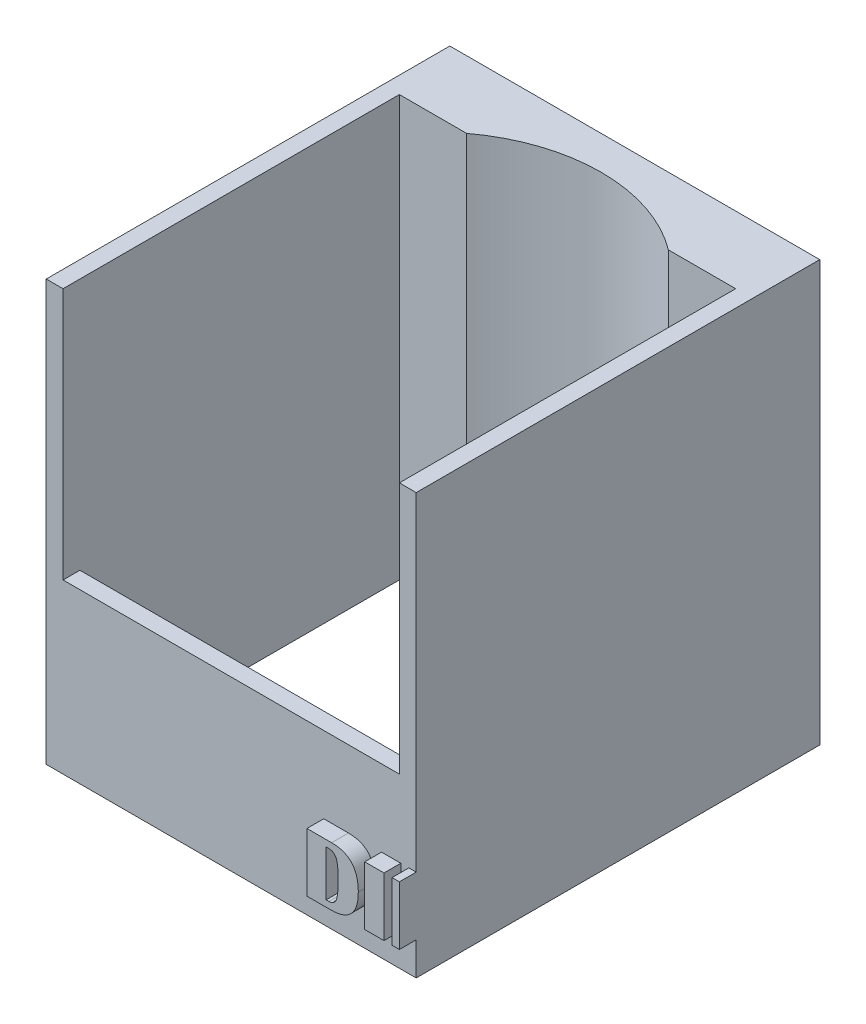
from build123d import *

# Parameters (mm, degrees)
SKETCH1_W                      = 670
SKETCH1_H                      = 120
BOSS_EXTRUDE1_DEPTH            = 530
SKETCH2_W                      = 100
SKETCH2_H                      = 200
SKETCH2_W_2                    = 650
SKETCH2_H_2                    = 250
CUT_EXTRUDE1_DEPTH             = 100
SKETCH3_R                      = 50
CUT_EXTRUDE2_DEPTH             = 260
F_12_0_12_DIAMETER_HOLE2_D     = 12
F_12_0_12_DIAMETER_HOLE2_DEPTH = 30
F_12_0_12_DIAMETER_HOLE2_TIP   = 3.605163714
SKETCH8_W                      = 650
SKETCH8_H                      = 50
BOSS_EXTRUDE2_DEPTH            = 5
SKETCH9_W                      = 10
SKETCH9_H                      = 250
CUT_EXTRUDE3_DEPTH             = 717
CUT_EXTRUDE4_DEPTH             = 5
SKETCH11_W                     = 10
SKETCH11_H                     = 100
BOSS_EXTRUDE3_DEPTH            = 78
BOSS_EXTRUDE3_2_DEPTH          = 78
BOSS_EXTRUDE3_3_DEPTH          = 78
SKETCH12_W                     = 20
SKETCH12_H                     = 30
CUT_EXTRUDE5_DEPTH             = 80
SKETCH15_W                     = 30
SKETCH15_H                     = 23.536156656
SKETCH15_H_2                   = 28.986603691
CUT_EXTRUDE7_DEPTH             = 35
SHELL1_T                       = -3
SKETCH16_W                     = 14
SKETCH16_H                     = 14
CUT_EXTRUDE8_DEPTH             = 35
SKETCH17_W                     = 5.729882812
SKETCH17_H                     = 17.428393554
SKETCH17_W_2                   = 13.369726562
SKETCH17_H_2                   = 3.342431641
BOSS_EXTRUDE4_DEPTH            = 5
SKETCH18_W                     = 670
SKETCH18_H                     = 280
CUT_EXTRUDE10_DEPTH            = 159
CUT_EXTRUDE11_DEPTH            = 863.670273187
CUT_EXTRUDE11_DEPTH_BACK       = 863.670273187
SKETCH19_W                     = 115
SKETCH19_H                     = 250
SKETCH19_W_2                   = 445
CUT_EXTRUDE12_DEPTH            = 777.739982373
CUT_EXTRUDE12_DEPTH_BACK       = 777.739982373
SKETCH20_W                     = 110
SKETCH20_H                     = 125


with BuildPart() as part:
    # Sketch1 → Boss-Extrude1 (new body)
    with BuildSketch(Plane(origin=(0, 0, 0), x_dir=(1, 0, 0), z_dir=(0, 1, 0))):
        with Locations((335, 60)):
            Rectangle(SKETCH1_W, SKETCH1_H)
    extrude(amount=BOSS_EXTRUDE1_DEPTH)

    # Sketch2 → Cut-Extrude1 (cut)
    with BuildSketch(Plane.XY):
        with Locations((60, 380)):
            Rectangle(SKETCH2_W, SKETCH2_H)
        with Locations((170, 380)):
            Rectangle(SKETCH2_W, SKETCH2_H)
        with Locations((280, 380)):
            Rectangle(SKETCH2_W, SKETCH2_H)
        with Locations((390, 380)):
            Rectangle(SKETCH2_W, SKETCH2_H)
        with Locations((500, 380)):
            Rectangle(SKETCH2_W, SKETCH2_H)
        with Locations((610, 380)):
            Rectangle(SKETCH2_W, SKETCH2_H)
        with Locations((335, 135)):
            Rectangle(SKETCH2_W_2, SKETCH2_H_2)
    extrude(amount=-CUT_EXTRUDE1_DEPTH, mode=Mode.SUBTRACT)

    # Sketch3 → Cut-Extrude2 (cut)
    with BuildSketch(Plane(origin=(0, 530, 0), x_dir=(1, 0, 0), z_dir=(0, 1, 0))):
        with Locations(Location((60, 60, 0), (0, 0, 270))):
            Circle(SKETCH3_R)
        with Locations(Location((170, 60, 0), (0, 0, 270))):
            Circle(SKETCH3_R)
        with Locations(Location((280, 60, 0), (0, 0, 270))):
            Circle(SKETCH3_R)
        with Locations(Location((390, 60, 0), (0, 0, 270))):
            Circle(SKETCH3_R)
        with Locations(Location((500, 60, 0), (0, 0, 270))):
            Circle(SKETCH3_R)
        with Locations(Location((610, 60, 0), (0, 0, 270))):
            Circle(SKETCH3_R)
    extrude(amount=-CUT_EXTRUDE2_DEPTH, mode=Mode.SUBTRACT)

    # Ø12.0 (12) Diameter Hole2
    with Locations(Plane(origin=(59.704642413, 270, -102.411697903), x_dir=(0, 0, 1), z_dir=(0, 1, 0))):
        with Locations((0, 0), (-0.195888006, 111.8520513), (0.014838595, 221.167624818), (-0.341843303, 331.364008353), (0.657723149, 441.008646429), (1.288998006, 549.811854685)):
            Hole(F_12_0_12_DIAMETER_HOLE2_D / 2, depth=F_12_0_12_DIAMETER_HOLE2_DEPTH)
            with Locations((0, 0, -(F_12_0_12_DIAMETER_HOLE2_DEPTH + F_12_0_12_DIAMETER_HOLE2_TIP / 2))):  # 118° drill point
                Cone(0, F_12_0_12_DIAMETER_HOLE2_D / 2, F_12_0_12_DIAMETER_HOLE2_TIP, mode=Mode.SUBTRACT)

    # Sketch8 → Boss-Extrude2 (add)
    with BuildSketch(Plane.XY):
        with Locations((335, 305)):
            Rectangle(SKETCH8_W, SKETCH8_H)
    extrude(amount=-BOSS_EXTRUDE2_DEPTH)

    # Sketch9 → Cut-Extrude3 (cut)
    with BuildSketch(Plane(origin=(670, 0, 0), x_dir=(0, 0, -1), z_dir=(1, 0, 0))):
        with Locations((15, 135)):
            Rectangle(SKETCH9_W, SKETCH9_H)
    extrude(amount=-CUT_EXTRUDE3_DEPTH, mode=Mode.SUBTRACT)

    # Sketch10 → Cut-Extrude4 (cut)
    with BuildSketch(Plane(origin=(0, 10, 0), x_dir=(1, 0, 0), z_dir=(0, 1, 0))):
        Polygon((365, 61.943560596), (350, 87.924322709), (320, 87.924322709), (305, 61.943560596), (320, 35.962798482), (350, 35.962798482), align=None)
    extrude(amount=-CUT_EXTRUDE4_DEPTH, mode=Mode.SUBTRACT)

    # Sketch12 → Cut-Extrude5 (cut)
    with BuildSketch(Plane.XY.offset(-100)):
        with Locations((85.198613037, 245)):
            Rectangle(SKETCH12_W, SKETCH12_H)
        with Locations((195.198613037, 245)):
            Rectangle(SKETCH12_W, SKETCH12_H)
        with Locations((305.198613037, 245)):
            Rectangle(SKETCH12_W, SKETCH12_H)
        with Locations((415.198613037, 245)):
            Rectangle(SKETCH12_W, SKETCH12_H)
        with Locations((525.198613037, 245)):
            Rectangle(SKETCH12_W, SKETCH12_H)
        with Locations((635.198613037, 245)):
            Rectangle(SKETCH12_W, SKETCH12_H)
    extrude(amount=-CUT_EXTRUDE5_DEPTH, mode=Mode.SUBTRACT)

    # Sketch17 → Boss-Extrude4 (add)
    # profile 1 of 9: a face of its own
    with BuildSketch(Plane.XY):
        with BuildLine():
            Line((527.508830928, 289.835452458), (527.508830928, 307.263846012))
            Line((527.508830928, 307.263846012), (534.861434459, 307.263846012))
            add(Edge.make_bspline(
                [(534.861434459, 307.263846012), (535.181337774, 307.258256848), (535.803061116, 307.24739446), (536.703508491, 307.139069344), (537.544992916, 306.975202489), (538.325061607, 306.737496792), (539.040841948, 306.426020155), (539.698044515, 306.051894954), (540.290333057, 305.605079277), (540.822348212, 305.090232636), (541.284521701, 304.502523111), (541.692171296, 303.852565801), (542.030284458, 303.129762281), (542.309377095, 302.341316546), (542.5243908, 301.484161689), (542.679660381, 300.560045938), (542.773357357, 299.567500804), (542.783368073, 298.883107022), (542.788518428, 298.530997273)],
                knots=[0, 0, 0, 0, 1.135059408, 2.20595691, 3.214417064, 4.174978569, 5.094187092, 5.980001006, 6.853065862, 7.720814779, 8.600404634, 9.50058483, 10.438414914, 11.426825708, 12.465239141, 13.571113463, 14.750376389, 16, 16, 16, 16], degree=3))
            add(Edge.make_bspline(
                [(542.788518428, 298.530997273), (542.781740751, 298.180151665), (542.768592871, 297.499553336), (542.676885992, 296.511518461), (542.516733301, 295.591080531), (542.296748778, 294.736450427), (542.003051046, 293.953120444), (541.654236167, 293.233205539), (541.233025793, 292.585291498), (540.753136904, 292.000029304), (540.204772188, 291.484681411), (539.587651059, 291.044279297), (538.910779309, 290.668464036), (538.169670382, 290.361903209), (537.364073889, 290.124869172), (536.495133477, 289.954199984), (535.562644449, 289.853487388), (534.920131033, 289.841584621), (534.58911581, 289.835452458)],
                knots=[0, 0, 0, 0, 1.228418252, 2.382983832, 3.470276728, 4.496757894, 5.468023682, 6.394867725, 7.292157164, 8.167372942, 9.039072913, 9.918728341, 10.815246345, 11.744296628, 12.720973084, 13.750736166, 14.841206188, 16, 16, 16, 16], degree=3))
            Line((534.58911581, 289.835452458), (527.508830928, 289.835452458))
        make_face()
        with BuildLine():
            Line((533.238713741, 291.745413395), (534.048208904, 291.745413395))
            add(Edge.make_bspline(
                [(534.048208904, 291.745413395), (534.172894012, 291.749291978), (534.413033311, 291.756761998), (534.758676231, 291.825976613), (535.075745017, 291.938271137), (535.365749176, 292.094802589), (535.623404602, 292.300450923), (535.848862806, 292.551404902), (536.04776914, 292.844737637), (536.217685755, 293.190205032), (536.364284647, 293.596533622), (536.481764702, 294.076367921), (536.592118304, 294.630928744), (536.673672739, 295.265507643), (536.740044562, 295.978448886), (536.788346679, 296.768428292), (536.812018936, 297.636801208), (536.817188964, 298.241258393), (536.819890499, 298.55711002)],
                knots=[0, 0, 0, 0, 0.728710832, 1.403472396, 2.052289494, 2.690292559, 3.321919393, 3.970736491, 4.656696891, 5.388631723, 6.217040872, 7.17856157, 8.275589967, 9.523440737, 10.918935818, 12.463926104, 14.152268318, 16, 16, 16, 16], degree=3))
            add(Edge.make_bspline(
                [(536.819890499, 298.55711002), (536.8171426, 298.871715251), (536.811863063, 299.476166083), (536.7886758, 300.343334385), (536.739579947, 301.133216935), (536.674703848, 301.843934916), (536.589660404, 302.476324031), (536.488366458, 303.031681737), (536.362441588, 303.507627045), (536.222158727, 303.914921549), (536.050140993, 304.256514038), (535.858357073, 304.554097881), (535.62547107, 304.79746827), (535.36991257, 305.004888479), (535.079348843, 305.160875844), (534.761320266, 305.273944358), (534.414185903, 305.34216807), (534.172870641, 305.349893944), (534.048208904, 305.353885075)],
                knots=[0, 0, 0, 0, 1.842836665, 3.540640921, 5.080358154, 6.47765669, 7.719902824, 8.816971715, 9.781579111, 10.601733135, 11.334613876, 12.017393917, 12.666641099, 13.29908421, 13.937911793, 14.587567384, 15.270347425, 16, 16, 16, 16], degree=3))
            Line((534.048208904, 305.353885075), (533.238713741, 305.353885075))
            Line((533.238713741, 305.353885075), (533.238713741, 291.745413395))
        make_face(mode=Mode.SUBTRACT)
    # profile 2 of 9: a face of its own
    with BuildSketch(Plane.XY):
        with Locations((547.563420772, 298.549649235)):
            Rectangle(SKETCH17_W, SKETCH17_H)
    # profile 3 of 9: a face of its own
    with BuildSketch(Plane.XY):
        Polygon((564.514324092, 307.263846012), (564.514324092, 305.115139958), (558.545696163, 305.115139958), (558.545696163, 299.862747379), (563.559343624, 299.862747379), (563.559343624, 297.714041325), (558.545696163, 297.714041325), (558.545696163, 289.835452458), (552.81581335, 289.835452458), (552.81581335, 307.263846012), align=None)
    # profile 4 of 9: a face of its own
    with BuildSketch(Plane.XY):
        Polygon((577.645305538, 307.263846012), (577.645305538, 305.115139958), (571.676677608, 305.115139958), (571.676677608, 299.862747379), (576.690325069, 299.862747379), (576.690325069, 297.714041325), (571.676677608, 297.714041325), (571.676677608, 289.835452458), (565.946794795, 289.835452458), (565.946794795, 307.263846012), align=None)
    # profile 5 of 9: a face of its own
    with BuildSketch(Plane.XY):
        with Locations((584.330168819, 287.448001286)):
            Rectangle(SKETCH17_W_2, SKETCH17_H_2)
    # profile 6 of 9: a face of its own
    with BuildSketch(Plane.XY):
        with BuildLine():
            Line((605.578484249, 307.263846012), (605.578484249, 295.602639195))
            add(Edge.make_bspline(
                [(605.578484249, 295.602639195), (605.574209777, 295.35989389), (605.565919345, 294.889083964), (605.480877158, 294.20653885), (605.349958188, 293.569747554), (605.15926554, 292.978838165), (604.911867049, 292.436847071), (604.616163877, 291.936663973), (604.260702644, 291.487723021), (603.847299908, 291.08966617), (603.386881991, 290.731670113), (602.867295001, 290.425440037), (602.293741958, 290.168488385), (601.66690529, 289.960990771), (600.988052682, 289.797299786), (600.254912883, 289.679078851), (599.467035781, 289.60781007), (598.923618241, 289.60048219), (598.643684673, 289.59670734)],
                knots=[0, 0, 0, 0, 1.108173197, 2.149326602, 3.136215123, 4.073726706, 4.978516626, 5.852185058, 6.72141202, 7.584905625, 8.467554395, 9.379216169, 10.332422268, 11.332766067, 12.390653242, 13.518530507, 14.721707419, 16, 16, 16, 16], degree=3))
            add(Edge.make_bspline(
                [(598.643684673, 289.59670734), (598.373688491, 289.600411437), (597.851346557, 289.607577482), (597.093280473, 289.679448684), (596.387523889, 289.797736542), (595.733050135, 289.960122315), (595.130189942, 290.169220301), (594.579048171, 290.42623041), (594.078350789, 290.732835498), (593.633858028, 291.090104794), (593.234289459, 291.486851767), (592.899913678, 291.940746827), (592.609043638, 292.435866034), (592.375223767, 292.980322997), (592.191754821, 293.570441519), (592.063541006, 294.20666921), (591.983676196, 294.889343196), (591.974661767, 295.359932437), (591.970012569, 295.602639195)],
                knots=[0, 0, 0, 0, 1.258901956, 2.435505865, 3.547148904, 4.59359074, 5.576649289, 6.5183682, 7.424469602, 8.307507093, 9.172751023, 10.042627298, 10.928839176, 11.845659241, 12.799442865, 13.80597989, 14.868432463, 16, 16, 16, 16], degree=3))
            Line((591.970012569, 295.602639195), (591.970012569, 307.263846012))
            Line((591.970012569, 307.263846012), (597.699895381, 307.263846012))
            Line((597.699895381, 307.263846012), (597.699895381, 295.457153889))
            add(Edge.make_bspline(
                [(597.699895381, 295.457153889), (597.700816195, 295.287996189), (597.702584578, 294.963135903), (597.729908723, 294.499051493), (597.768241004, 294.079064133), (597.828226169, 293.705517832), (597.90066041, 293.377063412), (597.989882091, 293.09281535), (598.094998068, 292.852496478), (598.225239063, 292.654232043), (598.380826623, 292.495135011), (598.55368342, 292.353231761), (598.757556996, 292.238543846), (598.987648905, 292.146224908), (599.243380948, 292.070549638), (599.526120553, 292.020376099), (599.83553351, 291.990763905), (600.049971942, 291.986424568), (600.161954402, 291.984158512)],
                knots=[0, 0, 0, 0, 1.622370975, 3.115695595, 4.458049099, 5.666011203, 6.742434742, 7.681714947, 8.519814998, 9.250928664, 9.942747364, 10.646898194, 11.389596108, 12.175933929, 13.021386247, 13.943159715, 14.925891993, 16, 16, 16, 16], degree=3))
            add(Edge.make_bspline(
                [(600.161954402, 291.984158512), (600.283927219, 291.987190593), (600.521124756, 291.993087005), (600.86597014, 292.03390861), (601.187714881, 292.103380086), (601.484890424, 292.205377303), (601.758665297, 292.332852529), (602.012761516, 292.484567923), (602.236391413, 292.674631152), (602.439076761, 292.888441291), (602.620738276, 293.128529789), (602.771757722, 293.399928575), (602.905501548, 293.697121508), (603.005823683, 294.025060118), (603.089837826, 294.379999499), (603.146989706, 294.763086929), (603.186210275, 295.174074524), (603.189394751, 295.457053988), (603.191033077, 295.602639195)],
                knots=[0, 0, 0, 0, 1.083870311, 2.107775948, 3.08105344, 4.003637981, 4.893545291, 5.761570557, 6.624657808, 7.49233129, 8.376387281, 9.291996285, 10.246843261, 11.267344133, 12.334180325, 13.486053461, 14.706643157, 16, 16, 16, 16], degree=3))
            Line((603.191033077, 295.602639195), (603.191033077, 307.263846012))
            Line((603.191033077, 307.263846012), (605.578484249, 307.263846012))
        make_face()
    # profile 7 of 9: a face of its own
    with BuildSketch(Plane.XY):
        with BuildLine():
            Line((619.731593227, 302.015183827), (616.739818477, 301.526502415))
            add(Edge.make_bspline(
                [(616.739818477, 301.526502415), (616.748849224, 301.670726223), (616.765660669, 301.939210177), (616.78429066, 302.312269209), (616.796668381, 302.625642376), (616.798628236, 302.814722915), (616.799504756, 302.899286839)],
                knots=[0, 0, 0, 0, 1.261802504, 2.348944521, 3.261585937, 4, 4, 4, 4], degree=3))
            add(Edge.make_bspline(
                [(616.799504756, 302.899286839), (616.798306068, 303.007660677), (616.795968139, 303.219033721), (616.750451916, 303.523894877), (616.694806916, 303.811547356), (616.604352699, 304.076787391), (616.488181329, 304.320314265), (616.348943917, 304.543955606), (616.184187178, 304.745078709), (615.995833421, 304.928129987), (615.778009957, 305.083200131), (615.536269472, 305.218702836), (615.269765326, 305.333844758), (614.978065514, 305.431346685), (614.660683072, 305.504624438), (614.319025281, 305.556776695), (613.952471696, 305.585673441), (613.699597795, 305.590260771), (613.568984889, 305.592630192)],
                knots=[0, 0, 0, 0, 1.079280541, 2.105035848, 3.067950317, 3.99715044, 4.889989748, 5.753421302, 6.617030865, 7.476358039, 8.364190572, 9.274590025, 10.235106994, 11.254473582, 12.337095886, 13.478601727, 14.697662529, 16, 16, 16, 16], degree=3))
            add(Edge.make_bspline(
                [(613.568984889, 305.592630192), (613.391954632, 305.58912286), (613.059112606, 305.582528579), (612.595688488, 305.495339748), (612.198743126, 305.361419257), (611.87165349, 305.163811893), (611.613188167, 304.909795747), (611.433841092, 304.593316589), (611.323009072, 304.224665915), (611.313400221, 303.959558324), (611.308367061, 303.820693775)],
                knots=[0, 0, 0, 0, 1.294917039, 2.43462794, 3.440028966, 4.347597256, 5.210608309, 6.06356377, 6.985685997, 8, 8, 8, 8], degree=3))
            add(Edge.make_bspline(
                [(611.308367061, 303.820693775), (611.317562032, 303.705133219), (611.336106628, 303.472068433), (611.47315858, 303.132808312), (611.695999602, 302.811560885), (612.009295906, 302.510664216), (612.404107796, 302.221967273), (612.884407504, 301.948533431), (613.450813789, 301.688189695), (613.862519081, 301.536023727), (614.080048656, 301.455624958)],
                knots=[0, 0, 0, 0, 0.716839541, 1.445735977, 2.240793036, 3.131329288, 4.131129903, 5.273471266, 6.559404876, 8, 8, 8, 8], degree=3))
            add(Edge.make_bspline(
                [(614.080048656, 301.455624958), (614.335934702, 301.364918412), (614.834564244, 301.188164095), (615.547657928, 300.88707802), (616.213068388, 300.5749594), (616.829579094, 300.246613346), (617.397833174, 299.90520698), (617.914851624, 299.544556457), (618.386199073, 299.173962102), (618.807001026, 298.783874588), (619.177995113, 298.378100064), (619.4958685, 297.952745357), (619.771807525, 297.51723103), (619.991113975, 297.061458502), (620.169645242, 296.594624218), (620.292698657, 296.11024444), (620.364288243, 295.609761088), (620.37516617, 295.270864226), (620.380681514, 295.099036213)],
                knots=[0, 0, 0, 0, 1.359488612, 2.649152603, 3.874964776, 5.039588756, 6.146130126, 7.193090393, 8.194917302, 9.146793662, 10.063845301, 10.944476293, 11.803344532, 12.641736646, 13.473440096, 14.302714936, 15.139439897, 16, 16, 16, 16], degree=3))
            add(Edge.make_bspline(
                [(620.380681514, 295.099036213), (620.374476075, 294.902306495), (620.362285176, 294.515820995), (620.280160209, 293.948630617), (620.138011896, 293.409496554), (619.938489338, 292.895972278), (619.681049879, 292.411946655), (619.366518754, 291.954381076), (618.996510229, 291.525099427), (618.5710008, 291.128381035), (618.102222518, 290.765302239), (617.587803957, 290.450854345), (617.034458515, 290.187092261), (616.444107988, 289.968993032), (615.81453624, 289.801373099), (615.145337453, 289.685291013), (614.438790193, 289.606619894), (613.954683001, 289.600062276), (613.70700941, 289.59670734)],
                knots=[0, 0, 0, 0, 0.972121714, 1.909782367, 2.824924061, 3.721832975, 4.62620438, 5.527836938, 6.46026819, 7.421000932, 8.398101015, 9.385579713, 10.394244048, 11.422703992, 12.491421888, 13.608778581, 14.776629625, 16, 16, 16, 16], degree=3))
            add(Edge.make_bspline(
                [(613.70700941, 289.59670734), (613.445745367, 289.599650312), (612.939893069, 289.605348413), (612.207608113, 289.66709241), (611.525297432, 289.760984454), (610.893395078, 289.899706116), (610.309273131, 290.072394336), (609.776099392, 290.288320955), (609.295310255, 290.547303481), (608.863217672, 290.843007892), (608.478306623, 291.175775461), (608.148120946, 291.551766865), (607.86942369, 291.967163224), (607.639947144, 292.421521488), (607.466477665, 292.917583541), (607.339164663, 293.449829748), (607.264537999, 294.021332449), (607.254747521, 294.414908557), (607.249700069, 294.617815586)],
                knots=[0, 0, 0, 0, 1.342201143, 2.598733168, 3.773451092, 4.878874364, 5.91991243, 6.900006476, 7.829142054, 8.72062616, 9.585588575, 10.436728592, 11.283829734, 12.149664931, 13.044964919, 13.977937424, 14.957531465, 16, 16, 16, 16], degree=3))
            add(Edge.make_bspline(
                [(607.249700069, 294.617815586), (607.250803815, 294.692425759), (607.253213998, 294.855347393), (607.260452266, 295.122772538), (607.275636683, 295.433682216), (607.29037174, 295.656130545), (607.298195171, 295.774237248)],
                knots=[0, 0, 0, 0, 0.773500207, 1.689044709, 2.77302154, 4, 4, 4, 4], degree=3))
            Line((607.298195171, 295.774237248), (610.36457777, 296.337526509))
            add(Edge.make_bspline(
                [(610.36457777, 296.337526509), (610.326952988, 296.136337493), (610.255606535, 295.754830366), (610.178678473, 295.21219969), (610.124206629, 294.733311493), (610.11767002, 294.435147371), (610.114641475, 294.297001835)],
                knots=[0, 0, 0, 0, 1.192988372, 2.262218769, 3.194850416, 4, 4, 4, 4], degree=3))
            add(Edge.make_bspline(
                [(610.114641475, 294.297001835), (610.116191817, 294.183708768), (610.119182568, 293.965156219), (610.159053378, 293.648552813), (610.215988606, 293.352999663), (610.302906772, 293.079707227), (610.411206928, 292.826307836), (610.544682453, 292.59538211), (610.704385489, 292.386485019), (610.887496571, 292.200099922), (611.094689168, 292.033628705), (611.327456494, 291.892756696), (611.58347653, 291.771733922), (611.864681562, 291.677479524), (612.167961721, 291.596080628), (612.497219749, 291.548235723), (612.849461228, 291.512043782), (613.092629543, 291.508500084), (613.218327999, 291.506668278)],
                knots=[0, 0, 0, 0, 1.135776692, 2.191015738, 3.19649269, 4.151244236, 5.061952528, 5.956281389, 6.819534407, 7.692823504, 8.571441916, 9.478554956, 10.416037156, 11.406231466, 12.450054172, 13.561596327, 14.739541482, 16, 16, 16, 16], degree=3))
            add(Edge.make_bspline(
                [(613.218327999, 291.506668278), (613.423996012, 291.510791273), (613.810619321, 291.518541853), (614.349272542, 291.616708407), (614.810575885, 291.768742445), (615.189785268, 291.991387532), (615.490778961, 292.278756613), (615.698005174, 292.637320004), (615.824813318, 293.05638326), (615.837728413, 293.355975238), (615.844524288, 293.513619419)],
                knots=[0, 0, 0, 0, 1.308765556, 2.460272085, 3.475015317, 4.388076298, 5.239673503, 6.095681635, 6.997954785, 8, 8, 8, 8], degree=3))
            add(Edge.make_bspline(
                [(615.844524288, 293.513619419), (615.833808824, 293.638242951), (615.811807312, 293.894126055), (615.644884004, 294.264515838), (615.382382362, 294.620631473), (615.016807277, 294.962984909), (614.551376589, 295.293471235), (613.986957743, 295.616730224), (613.322148235, 295.933112033), (612.83677959, 296.119639164), (612.580430889, 296.21815395)],
                knots=[0, 0, 0, 0, 0.667930748, 1.371427933, 2.146459016, 3.034714139, 4.04893387, 5.207327294, 6.525042705, 8, 8, 8, 8], degree=3))
            add(Edge.make_bspline(
                [(612.580430889, 296.21815395), (612.374354345, 296.29679374), (611.970646869, 296.450850434), (611.394079385, 296.713586304), (610.853066711, 296.987016804), (610.357486361, 297.288235735), (609.896382561, 297.599610528), (609.477036946, 297.932256792), (609.09841673, 298.284556341), (608.758710772, 298.653375077), (608.457302107, 299.038989264), (608.199448649, 299.444659231), (607.977533299, 299.866789834), (607.798609588, 300.308107488), (607.65975715, 300.767821241), (607.559616231, 301.244439392), (607.497905054, 301.739995674), (607.491630423, 302.075933546), (607.488445186, 302.246468159)],
                knots=[0, 0, 0, 0, 1.249558333, 2.447906163, 3.58867143, 4.682264114, 5.731748367, 6.739728761, 7.711906036, 8.659384707, 9.578321416, 10.481344598, 11.379544271, 12.277135726, 13.175418307, 14.097160112, 15.034047388, 16, 16, 16, 16], degree=3))
            add(Edge.make_bspline(
                [(607.488445186, 302.246468159), (607.49282555, 302.439538736), (607.501402184, 302.817565692), (607.587451154, 303.36980586), (607.719291893, 303.894921371), (607.910558542, 304.389343064), (608.156192894, 304.852853762), (608.453187669, 305.288766511), (608.804241719, 305.697593471), (609.213503754, 306.066686531), (609.657214714, 306.407618241), (610.14376173, 306.697651931), (610.658716537, 306.950861947), (611.210636666, 307.148827868), (611.791820619, 307.313252612), (612.408080529, 307.421140415), (613.056315391, 307.490701612), (613.499160755, 307.498567824), (613.725661373, 307.502591129)],
                knots=[0, 0, 0, 0, 1.01033566, 1.978209831, 2.919499157, 3.840961976, 4.746855014, 5.660740114, 6.597989116, 7.56120833, 8.541877795, 9.523498025, 10.522416858, 11.542172371, 12.589598349, 13.681636521, 14.814234488, 16, 16, 16, 16], degree=3))
            add(Edge.make_bspline(
                [(613.725661373, 307.502591129), (613.968269855, 307.498219033), (614.438190994, 307.489750488), (615.120391152, 307.426787419), (615.755073228, 307.319142339), (616.345153155, 307.171557286), (616.887304575, 306.977590666), (617.384933999, 306.742393454), (617.834452216, 306.46201507), (618.236961315, 306.139451502), (618.593086714, 305.773322851), (618.897467704, 305.361641069), (619.158701245, 304.909408454), (619.366684143, 304.412232174), (619.529870326, 303.873247147), (619.649133834, 303.29158184), (619.720420497, 302.667301443), (619.72779778, 302.236712324), (619.731593227, 302.015183827)],
                knots=[0, 0, 0, 0, 1.248314423, 2.417925914, 3.521398822, 4.558068205, 5.543720209, 6.479599284, 7.385061127, 8.263440163, 9.127722873, 10.00561236, 10.891325273, 11.808802823, 12.772251995, 13.784947978, 14.860405143, 16, 16, 16, 16], degree=3))
        make_face()
    # profile 8 of 9: a face of its own
    with BuildSketch(Plane.XY):
        Polygon((633.989153194, 307.263846012), (633.989153194, 305.115139958), (628.020525264, 305.115139958), (628.020525264, 300.340237614), (633.034172725, 300.340237614), (633.034172725, 298.191531559), (628.020525264, 298.191531559), (628.020525264, 291.984158512), (634.944133663, 291.984158512), (634.944133663, 289.835452458), (622.290642452, 289.835452458), (622.290642452, 307.263846012), align=None)
    # profile 9 of 9: a face of its own
    with BuildSketch(Plane.XY):
        with BuildLine():
            Line((636.376604366, 289.835452458), (636.376604366, 307.263846012))
            Line((636.376604366, 307.263846012), (643.990335369, 307.263846012))
            add(Edge.make_bspline(
                [(643.990335369, 307.263846012), (644.237946498, 307.261150834), (644.721600887, 307.25588639), (645.426490561, 307.189203683), (646.094808274, 307.090496236), (646.724915796, 306.949857504), (647.317873659, 306.767252686), (647.871119087, 306.542146), (648.390701058, 306.282329135), (648.864494846, 305.976472528), (649.295093616, 305.642889252), (649.669668547, 305.279483604), (649.990389523, 304.894749072), (650.250664962, 304.483256345), (650.454275633, 304.048690948), (650.59581384, 303.587791605), (650.684089268, 303.104102537), (650.695510601, 302.772834174), (650.701311397, 302.604585835)],
                knots=[0, 0, 0, 0, 1.303269877, 2.545653735, 3.724355284, 4.8584284, 5.941462088, 6.987020715, 8.000098032, 8.995332524, 9.951400474, 10.863507538, 11.737823931, 12.582415999, 13.420128714, 14.25671499, 15.114600608, 16, 16, 16, 16], degree=3))
            add(Edge.make_bspline(
                [(650.701311397, 302.604585835), (650.698282873, 302.472674957), (650.692382063, 302.215658276), (650.651041486, 301.838684287), (650.580643818, 301.480313933), (650.481036683, 301.139915259), (650.347814833, 300.820175594), (650.191279492, 300.517863507), (650.009772227, 300.230553342), (649.788675198, 299.970497982), (649.548268341, 299.722842359), (649.274558803, 299.497116911), (648.974487035, 299.288655528), (648.642526299, 299.104010513), (648.287619671, 298.928055749), (647.899038177, 298.784921972), (647.486819978, 298.644749395), (647.19793098, 298.577036306), (647.049257183, 298.54218845)],
                knots=[0, 0, 0, 0, 1.057156483, 2.059775939, 3.035078039, 3.981068617, 4.897189472, 5.80650904, 6.70770952, 7.613691521, 8.536886357, 9.470937334, 10.45233069, 11.461024139, 12.51295332, 13.623444893, 14.776929983, 16, 16, 16, 16], degree=3))
            add(Edge.make_bspline(
                [(647.049257183, 298.54218845), (647.19164695, 298.499279419), (647.467865022, 298.416041346), (647.856360945, 298.265600017), (648.211652989, 298.111536308), (648.524185739, 297.936781388), (648.807636894, 297.762122504), (649.047122259, 297.564301324), (649.255235567, 297.361673563), (649.425188343, 297.135464734), (649.570253643, 296.882344437), (649.694827156, 296.586596707), (649.815179167, 296.247423665), (649.917667348, 295.859098311), (650.004750555, 295.423699276), (650.088222437, 294.944027189), (650.153853601, 294.416024546), (650.187587341, 294.048412906), (650.2051692, 293.856815525)],
                knots=[0, 0, 0, 0, 1.149282524, 2.229462177, 3.219229774, 4.139917433, 4.995948464, 5.788695735, 6.536448429, 7.236319808, 7.968460079, 8.78645307, 9.713791991, 10.749194692, 11.887975363, 13.146018663, 14.512518948, 16, 16, 16, 16], degree=3))
            add(Edge.make_bspline(
                [(650.2051692, 293.856815525), (650.225980287, 293.627849833), (650.265975604, 293.187817268), (650.348933081, 292.554613589), (650.44386163, 291.974357025), (650.555874504, 291.44528724), (650.681301216, 290.967898855), (650.821280597, 290.540469593), (650.979920039, 290.165788217), (651.10484481, 289.941461656), (651.163880062, 289.835452458)],
                knots=[0, 0, 0, 0, 1.324580516, 2.545615266, 3.678710841, 4.711533017, 5.660403917, 6.521349952, 7.301239649, 8, 8, 8, 8], degree=3))
            Line((651.163880062, 289.835452458), (645.213904094, 289.835452458))
            add(Edge.make_bspline(
                [(645.213904094, 289.835452458), (645.12229736, 290.069847279), (644.935171241, 290.548648246), (644.7595281, 291.319414791), (644.64846922, 292.142514735), (644.635117598, 292.70994511), (644.628232479, 293.002555653)],
                knots=[0, 0, 0, 0, 0.930410518, 1.900560147, 2.917368081, 4, 4, 4, 4], degree=3))
            Line((644.628232479, 293.002555653), (644.605850124, 294.002300831))
            Line((644.605850124, 294.002300831), (644.579737377, 295.266903874))
            add(Edge.make_bspline(
                [(644.579737377, 295.266903874), (644.573694669, 295.477395004), (644.562357007, 295.872330118), (644.469348432, 296.426164013), (644.30178735, 296.894645884), (644.073222546, 297.287223005), (643.766741442, 297.590613479), (643.39104803, 297.804152917), (642.950456912, 297.93396284), (642.634664848, 297.946292392), (642.468335247, 297.952786442)],
                knots=[0, 0, 0, 0, 1.295300309, 2.430314163, 3.439929415, 4.342995669, 5.203512789, 6.060756153, 6.978588463, 8, 8, 8, 8], degree=3))
            Line((642.468335247, 297.952786442), (642.106487178, 297.952786442))
            Line((642.106487178, 297.952786442), (642.106487178, 289.835452458))
            Line((642.106487178, 289.835452458), (636.376604366, 289.835452458))
        make_face()
        with BuildLine():
            Line((642.106487178, 299.862747379), (642.617550945, 299.862747379))
            add(Edge.make_bspline(
                [(642.617550945, 299.862747379), (642.722054451, 299.865172716), (642.925280724, 299.869889229), (643.220054897, 299.898289891), (643.494111408, 299.951809873), (643.749840966, 300.021017819), (643.984372137, 300.114851792), (644.200147241, 300.225818296), (644.391160406, 300.362685327), (644.565327067, 300.516342321), (644.718148635, 300.691986294), (644.850351299, 300.889034217), (644.961199162, 301.106225057), (645.056078491, 301.342818683), (645.125883912, 301.600830857), (645.173262731, 301.879472914), (645.203404658, 302.177423605), (645.207875435, 302.383174491), (645.210173702, 302.488943669)],
                knots=[0, 0, 0, 0, 1.184986479, 2.304423995, 3.352332712, 4.347714965, 5.303263624, 6.211353909, 7.091434645, 7.960150225, 8.839440182, 9.723126897, 10.64371617, 11.599264829, 12.608232147, 13.667459739, 14.800924404, 16, 16, 16, 16], degree=3))
            add(Edge.make_bspline(
                [(645.210173702, 302.488943669), (645.207875435, 302.594712847), (645.203404658, 302.800463732), (645.173262731, 303.098414423), (645.125883912, 303.37705648), (645.056078491, 303.635068654), (644.961199162, 303.87166228), (644.850351299, 304.08885312), (644.718148635, 304.285901043), (644.565327067, 304.461545017), (644.391160406, 304.61520201), (644.200147241, 304.752069041), (643.984372137, 304.863035546), (643.749840966, 304.956869518), (643.494111408, 305.026077464), (643.220054897, 305.079597446), (642.925280724, 305.107998108), (642.722054451, 305.112714621), (642.617550945, 305.115139958)],
                knots=[0, 0, 0, 0, 1.199075596, 2.332540261, 3.391767853, 4.400735171, 5.35628383, 6.276873103, 7.160559818, 8.039849775, 8.908565355, 9.788646091, 10.696736376, 11.652285035, 12.647667288, 13.695576005, 14.815013521, 16, 16, 16, 16], degree=3))
            Line((642.617550945, 305.115139958), (642.106487178, 305.115139958))
            Line((642.106487178, 305.115139958), (642.106487178, 299.862747379))
        make_face(mode=Mode.SUBTRACT)
    extrude(amount=BOSS_EXTRUDE4_DEPTH)


with BuildPart() as body_2:
    # Sketch11 → Boss-Extrude3 (new body)
    with BuildSketch(Plane.XY.offset(-100)):
        with Locations((255, 60)):
            Rectangle(SKETCH11_W, SKETCH11_H)
    extrude(amount=BOSS_EXTRUDE3_DEPTH)


with BuildPart() as body_3:
    # Sketch11 → Boss-Extrude3 2 (new body)
    with BuildSketch(Plane.XY.offset(-100)):
        with Locations((415, 60)):
            Rectangle(SKETCH11_W, SKETCH11_H)
    extrude(amount=BOSS_EXTRUDE3_2_DEPTH)


with BuildPart() as body_4:
    # Sketch11 → Boss-Extrude3 3 (new body)
    with BuildSketch(Plane.XY.offset(-100)):
        Polygon((25, 198.45686471), (325, 145.558770497), (325, 122.01775856), (345, 122.01775856), (345, 145.558770497), (645, 198.45686471), align=None)
    extrude(amount=BOSS_EXTRUDE3_3_DEPTH)

    # Sketch15 → Cut-Extrude7 (cut)
    with BuildSketch(Plane(origin=(345, 0, 0), x_dir=(0, 0, -1), z_dir=(1, 0, 0))):
        with Locations((35, 133.231921672)):
            Rectangle(SKETCH15_W, SKETCH15_H)
        with Locations((85, 130.506698154)):
            Rectangle(SKETCH15_W, SKETCH15_H_2)
    extrude(amount=-CUT_EXTRUDE7_DEPTH, mode=Mode.SUBTRACT)

    # Shell1
    shell1_openings = [body_4.faces().sort_by_distance(p)[0] for p in [
        (335, 198.45686471, -61),
    ]]
    offset(amount=SHELL1_T, openings=shell1_openings, kind=Kind.INTERSECTION)

    # Sketch16 → Cut-Extrude8 (cut)
    with BuildSketch(Plane.XZ.offset(-122.01775856)):
        with Locations((335, -60)):
            Rectangle(SKETCH16_W, SKETCH16_H)
    extrude(amount=-CUT_EXTRUDE8_DEPTH, mode=Mode.SUBTRACT)


with BuildPart() as cut_extrude10_tool:
    # Sketch18 → Cut-Extrude10 (new body)
    with BuildSketch(Plane.XY):
        with Locations((335, 140)):
            Rectangle(SKETCH18_W, SKETCH18_H)
    extrude(amount=-CUT_EXTRUDE10_DEPTH)


with BuildPart() as part_1:
    add(part.part)

    # Cut-Extrude10: cut by cut_extrude10_tool
    add(cut_extrude10_tool.part, mode=Mode.SUBTRACT)

    # Sketch19 → Cut-Extrude11 (cut, two sides: drawn at the far end of the back side and taken through both)
    with BuildSketch(Plane.XY.offset(-CUT_EXTRUDE11_DEPTH_BACK)):
        with Locations((612.5, 405)):
            Rectangle(SKETCH19_W, SKETCH19_H)
        with Locations((222.5, 405)):
            Rectangle(SKETCH19_W_2, SKETCH19_H)
    extrude(amount=CUT_EXTRUDE11_DEPTH + CUT_EXTRUDE11_DEPTH_BACK, mode=Mode.SUBTRACT)

    # Sketch20 → Cut-Extrude12 (cut, two sides: drawn at the far end of the back side and taken through both)
    with BuildSketch(Plane.XY.offset(-CUT_EXTRUDE12_DEPTH_BACK)):
        with Locations((500, 467.5)):
            Rectangle(SKETCH20_W, SKETCH20_H)
    extrude(amount=CUT_EXTRUDE12_DEPTH + CUT_EXTRUDE12_DEPTH_BACK, mode=Mode.SUBTRACT)


with BuildPart() as body_2_1:
    add(body_2.part)

    # Cut-Extrude10: cut by cut_extrude10_tool
    add(cut_extrude10_tool.part, mode=Mode.SUBTRACT)


with BuildPart() as body_3_1:
    add(body_3.part)

    # Cut-Extrude10: cut by cut_extrude10_tool
    add(cut_extrude10_tool.part, mode=Mode.SUBTRACT)


with BuildPart() as body_4_1:
    add(body_4.part)

    # Cut-Extrude10: cut by cut_extrude10_tool
    add(cut_extrude10_tool.part, mode=Mode.SUBTRACT)


solid = part_1.part
